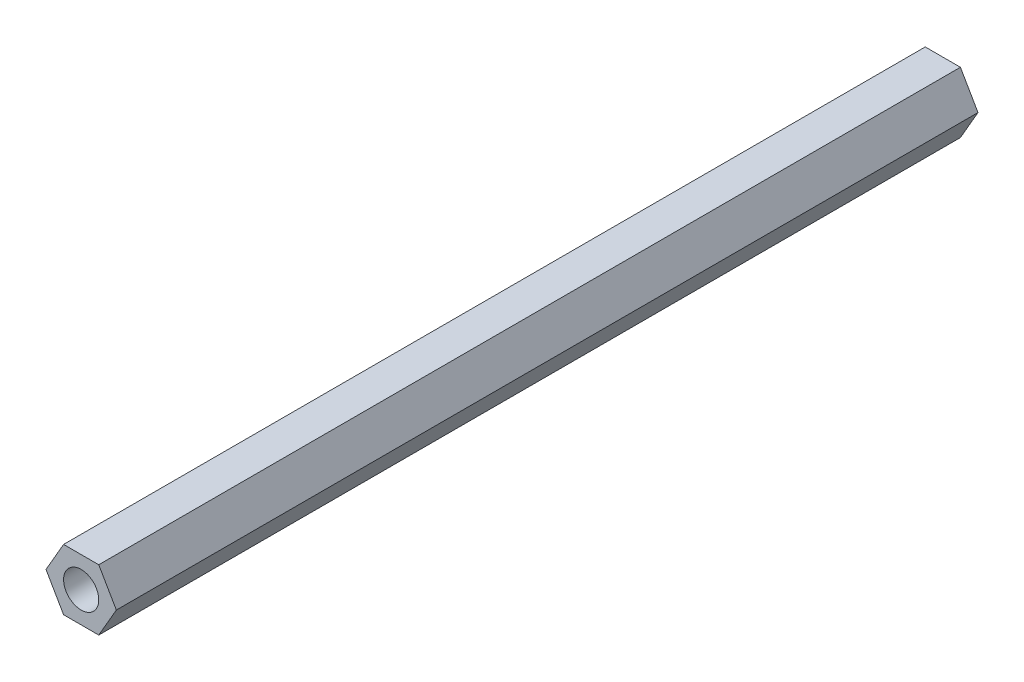
from build123d import *

# Parameters (mm, degrees)
SKETCH_1_R      = 2
EXTRUDE_1_DEPTH = 98


with BuildPart() as part:
    # 草图1 → 凸台-拉伸1 (new body)
    with BuildSketch(Plane.XY):
        Polygon((-25.8, 29.8), (-27.8, 33.264101615), (-31.8, 33.264101615), (-33.8, 29.8), (-31.8, 26.335898385), (-27.8, 26.335898385), align=None)
        with Locations((-29.8, 29.8)):
            Circle(SKETCH_1_R, mode=Mode.SUBTRACT)
    extrude(amount=EXTRUDE_1_DEPTH)


solid = part.part
